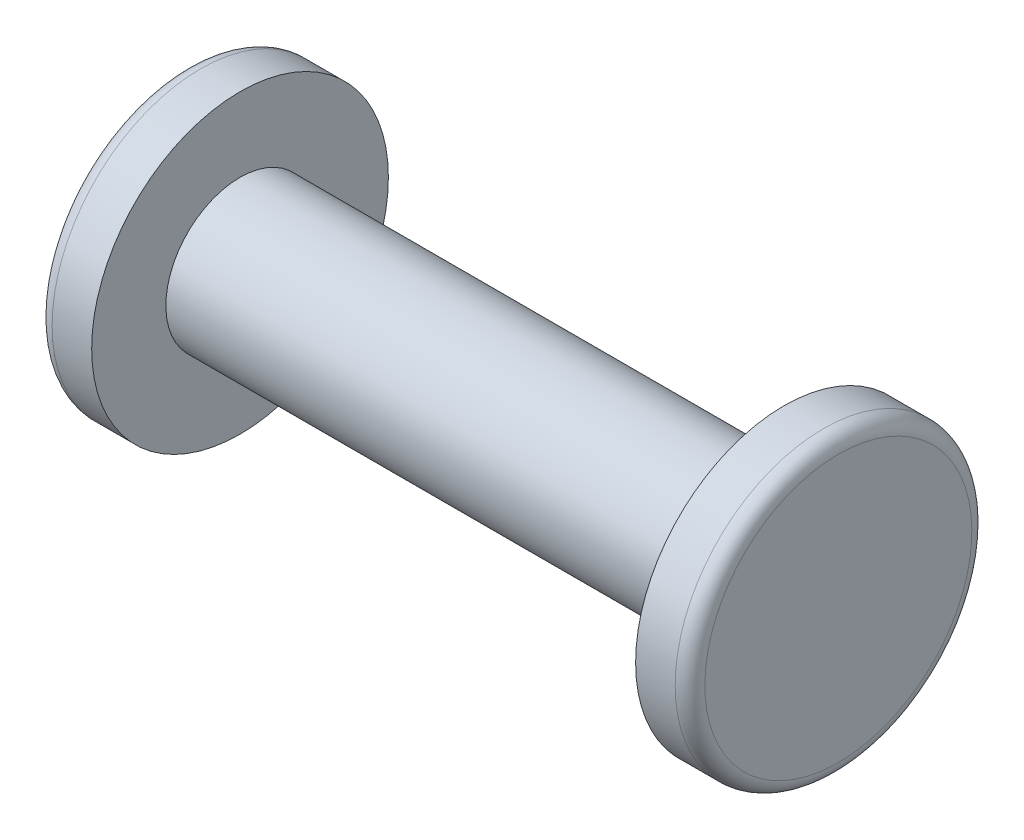
from build123d import *


with BuildPart() as part:
    # 草图1 → 旋转1 (revolve)
    with BuildSketch(Plane.XY):
        with BuildLine():
            Line((0, 0), (0, 2.7))
            ThreePointArc((0, 2.7), (0.087867966, 2.912132034), (0.3, 3))
            Line((0.3, 3), (1.1, 3))
            Line((1.1, 3), (1.1, 1.5))
            Line((1.1, 1.5), (12.1, 1.5))
            Line((12.1, 1.5), (12.1, 3))
            Line((12.1, 3), (12.9, 3))
            ThreePointArc((12.9, 3), (13.112132034, 2.912132034), (13.2, 2.7))
            Line((13.2, 2.7), (13.2, 0))
            Line((13.2, 0), (0, 0))
        make_face()
    revolve(axis=Axis((13.2, 0, 0), (-1, 0, 0)))


solid = part.part
